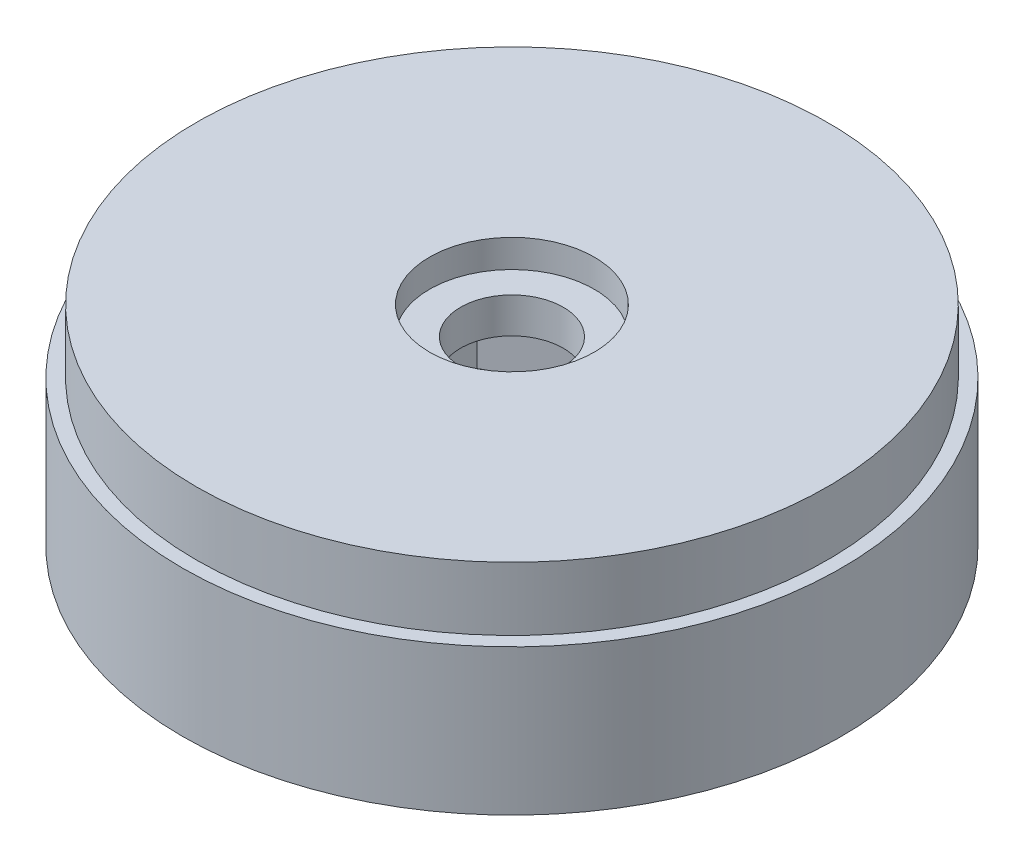
from build123d import *

# Parameters (mm, degrees)
SKETCH1_R           = 26
BOSS_EXTRUDE1_DEPTH = 11.5
SKETCH2_R           = 24.9
SKETCH2_R_2         = 4.05
BOSS_EXTRUDE2_DEPTH = 5
SKETCH3_R           = 8
CUT_EXTRUDE1_DEPTH  = 7
SKETCH4_R           = 6.5
CUT_EXTRUDE2_DEPTH  = 2.2


with BuildPart() as part:
    # Sketch1 → Boss-Extrude1 (new body)
    with BuildSketch(Plane(origin=(0, 0, 0), x_dir=(1, 0, 0), z_dir=(0, 1, 0))):
        with Locations(Location((0, 0, 0), (0, 0, 270))):
            Circle(SKETCH1_R)
        Polygon((0, 7.505553499), (-6.5, 3.75277675), (-6.5, -3.75277675), (0, -7.505553499), (6.5, -3.75277675), (6.5, 3.75277675), align=None, mode=Mode.SUBTRACT)
    extrude(amount=BOSS_EXTRUDE1_DEPTH)

    # Sketch2 → Boss-Extrude2 (add)
    with BuildSketch(Plane(origin=(0, 11.5, 0), x_dir=(1, 0, 0), z_dir=(0, 1, 0))):
        with Locations(Location((0, 0, 0), (0, 0, 270))):
            Circle(SKETCH2_R)
        with Locations(Location((0, 0, 0), (0, 0, 270))):
            Circle(SKETCH2_R_2, mode=Mode.SUBTRACT)
    extrude(amount=BOSS_EXTRUDE2_DEPTH)

    # Sketch3 → Cut-Extrude1 (cut)
    with BuildSketch(Plane.XZ):
        with Locations(Location((0, 0, 0), (0, 0, 270))):
            Circle(SKETCH3_R)
    extrude(amount=-CUT_EXTRUDE1_DEPTH, mode=Mode.SUBTRACT)

    # Sketch4 → Cut-Extrude2 (cut)
    with BuildSketch(Plane(origin=(0, 16.5, 0), x_dir=(1, 0, 0), z_dir=(0, 1, 0))):
        with Locations(Location((0, 0, 0), (0, 0, 270))):
            Circle(SKETCH4_R)
    extrude(amount=-CUT_EXTRUDE2_DEPTH, mode=Mode.SUBTRACT)


solid = part.part
